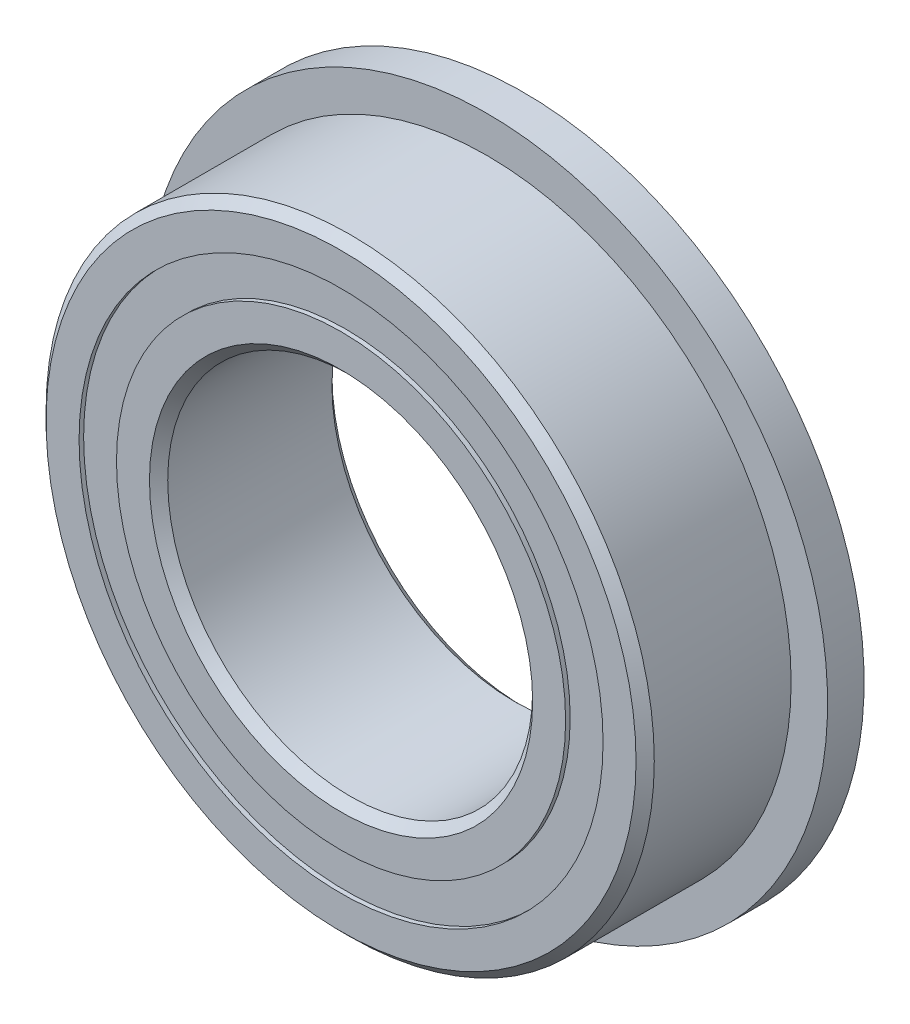
from build123d import *

# Parameters (mm, degrees)
CIRPATTERN1_COUNT = 12
SKETCH5_W         = 0.690752766
SKETCH5_H         = 0.615384616
SKETCH6_W         = 0.6
SKETCH6_H         = 1.292307692


with BuildPart() as part:
    # Sketch1 → Revolve1 (revolve)
    with BuildSketch(Plane(origin=(0, 0, 0), x_dir=(0, 0, -1), z_dir=(1, 0, 0))):
        with BuildLine():
            Line((1.35, 5), (-1.35, 5))
            Line((-1.35, 5), (-1.5, 4.85))
            Line((-1.5, 4.85), (-1.5, 4.307692308))
            Line((-1.5, 4.307692308), (-0.666666667, 4.307692308))
            ThreePointArc((-0.666666667, 4.307692308), (0, 4.734247234), (0.666666667, 4.307692308))
            Line((0.666666667, 4.307692308), (1.5, 4.307692308))
            Line((1.5, 4.307692308), (1.5, 4.85))
            Line((1.5, 4.85), (1.35, 5))
        make_face()
    revolve(axis=Axis((0, 0, 1.5), (0, 0, -1)))

    # Sketch6 → Revolve6 (revolve)
    with BuildSketch(Plane(origin=(0, 0, 0), x_dir=(0, 0, -1), z_dir=(1, 0, 0))):
        with Locations((1.2, 4.953846154)):
            Rectangle(SKETCH6_W, SKETCH6_H)
    revolve(axis=Axis((0, 0, -1.5), (0, 0, 1)))


with BuildPart() as body_2:
    # Sketch3 → Revolve3 (revolve)
    with BuildSketch(Plane(origin=(0, 0, 0), x_dir=(0, 0, -1), z_dir=(1, 0, 0))):
        with BuildLine():
            Line((-1.5, 3.692307692), (-0.666666667, 3.692307692))
            ThreePointArc((-0.666666667, 3.692307692), (0, 3.265752766), (0.666666667, 3.692307692))
            Line((0.666666667, 3.692307692), (1.5, 3.692307692))
            Line((1.5, 3.692307692), (1.5, 3.15))
            Line((1.5, 3.15), (1.35, 3))
            Line((1.35, 3), (-1.35, 3))
            Line((-1.35, 3), (-1.5, 3.15))
            Line((-1.5, 3.15), (-1.5, 3.692307692))
        make_face()
    revolve(axis=Axis((0, 0, 1.5), (0, 0, -1)))


with BuildPart() as body_3:
    # Sketch4 → Revolve4 (revolve)
    with BuildSketch(Plane(origin=(0, 0, 0), x_dir=(0, 0, -1), z_dir=(1, 0, 0))):
        with BuildLine():
            Line((-0.734247234, 4), (0.734247234, 4))
            ThreePointArc((0.734247234, 4), (0, 4.734247234), (-0.734247234, 4))
        make_face()
    revolve(axis=Axis((0, 4, 0.734247234), (0, 0, -1)))


with BuildPart() as cirpattern1_1:
    # CirPattern1: pattern copy
    add(body_3.part.rotate(Axis((0, 0, -1.5), (0, 0, 1)), 1 * 360 / CIRPATTERN1_COUNT))


with BuildPart() as cirpattern1_2:
    # CirPattern1: pattern copy
    add(body_3.part.rotate(Axis((0, 0, -1.5), (0, 0, 1)), 2 * 360 / CIRPATTERN1_COUNT))


with BuildPart() as cirpattern1_3:
    # CirPattern1: pattern copy
    add(body_3.part.rotate(Axis((0, 0, -1.5), (0, 0, 1)), 3 * 360 / CIRPATTERN1_COUNT))


with BuildPart() as cirpattern1_4:
    # CirPattern1: pattern copy
    add(body_3.part.rotate(Axis((0, 0, -1.5), (0, 0, 1)), 4 * 360 / CIRPATTERN1_COUNT))


with BuildPart() as cirpattern1_5:
    # CirPattern1: pattern copy
    add(body_3.part.rotate(Axis((0, 0, -1.5), (0, 0, 1)), 5 * 360 / CIRPATTERN1_COUNT))


with BuildPart() as cirpattern1_6:
    # CirPattern1: pattern copy
    add(body_3.part.rotate(Axis((0, 0, -1.5), (0, 0, 1)), 6 * 360 / CIRPATTERN1_COUNT))


with BuildPart() as cirpattern1_7:
    # CirPattern1: pattern copy
    add(body_3.part.rotate(Axis((0, 0, -1.5), (0, 0, 1)), 7 * 360 / CIRPATTERN1_COUNT))


with BuildPart() as cirpattern1_8:
    # CirPattern1: pattern copy
    add(body_3.part.rotate(Axis((0, 0, -1.5), (0, 0, 1)), 8 * 360 / CIRPATTERN1_COUNT))


with BuildPart() as cirpattern1_9:
    # CirPattern1: pattern copy
    add(body_3.part.rotate(Axis((0, 0, -1.5), (0, 0, 1)), 9 * 360 / CIRPATTERN1_COUNT))


with BuildPart() as cirpattern1_10:
    # CirPattern1: pattern copy
    add(body_3.part.rotate(Axis((0, 0, -1.5), (0, 0, 1)), 10 * 360 / CIRPATTERN1_COUNT))


with BuildPart() as cirpattern1_11:
    # CirPattern1: pattern copy
    add(body_3.part.rotate(Axis((0, 0, -1.5), (0, 0, 1)), 11 * 360 / CIRPATTERN1_COUNT))


with BuildPart() as body_15:
    # Sketch5 → Revolve5 (revolve)
    with BuildSketch(Plane(origin=(0, 0, 0), x_dir=(0, 0, -1), z_dir=(1, 0, 0))):
        with Locations((-1.079623617, 4)):
            Rectangle(SKETCH5_W, SKETCH5_H)
        with Locations((1.079623617, 4)):
            Rectangle(SKETCH5_W, SKETCH5_H)
    revolve(axis=Axis((0, 0, 1.5), (0, 0, -1)))


solid = Compound([part.part, body_2.part, body_3.part, cirpattern1_1.part, cirpattern1_2.part, cirpattern1_3.part, cirpattern1_4.part, cirpattern1_5.part, cirpattern1_6.part, cirpattern1_7.part, cirpattern1_8.part, cirpattern1_9.part, cirpattern1_10.part, cirpattern1_11.part, body_15.part])
